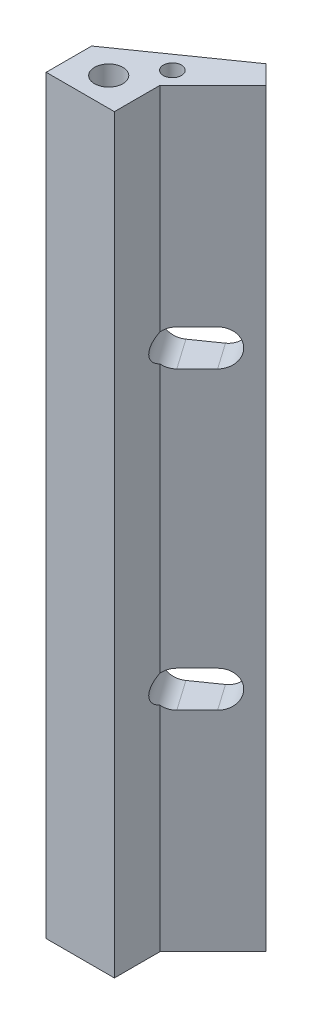
from build123d import *

# Parameters (mm, degrees)
BOSS_EXTRUDE1_DEPTH       = 66
M3X0_5_TAPPED_HOLE1_D     = 2.5
M3X0_5_TAPPED_HOLE1_DEPTH = 7.5
M3X0_5_TAPPED_HOLE1_TIP   = 0.751075774
M2X0_4_TAPPED_HOLE1_D     = 1.6
M2X0_4_TAPPED_HOLE1_DEPTH = 5.2
M2X0_4_TAPPED_HOLE1_TIP   = 0.480688495
M3X0_5_TAPPED_HOLE2_D     = 2.5
M3X0_5_TAPPED_HOLE2_DEPTH = 7.5
M3X0_5_TAPPED_HOLE2_TIP   = 0.751075774
M2X0_4_TAPPED_HOLE2_D     = 1.6
M2X0_4_TAPPED_HOLE2_DEPTH = 5.2
M2X0_4_TAPPED_HOLE2_TIP   = 0.480688495
CUT_EXTRUDE1_DEPTH        = 67.749502158


with BuildPart() as part:
    # Sketch1 → Boss-Extrude1 (new body)
    with BuildSketch(Plane(origin=(0, 66, 0), x_dir=(1, 0, 0), z_dir=(0, 1, 0))):
        Polygon((3.829824533, 1.282917234), (-5.180847956, -5.026423564), (-5.180847956, -9.026423564), (0.819152044, -9.026423564), (0.819152044, -5.026423564), (5.479158688, -0.366416921), align=None)
    extrude(amount=-BOSS_EXTRUDE1_DEPTH)

    # M3x0.5 Tapped Hole1
    with Locations(Plane(origin=(0, 0, 0), x_dir=(-1, 0, 0), z_dir=(0, -1, 0))):
        with Locations((2.180847956, -6.526423564)):
            Hole(M3X0_5_TAPPED_HOLE1_D / 2, depth=M3X0_5_TAPPED_HOLE1_DEPTH)
            with Locations((0, 0, -(M3X0_5_TAPPED_HOLE1_DEPTH + M3X0_5_TAPPED_HOLE1_TIP / 2))):  # 118° drill point
                Cone(0, M3X0_5_TAPPED_HOLE1_D / 2, M3X0_5_TAPPED_HOLE1_TIP, mode=Mode.SUBTRACT)

    # M2x0.4 Tapped Hole1
    with Locations(Plane(origin=(0, 0, 0), x_dir=(-1, 0, 0), z_dir=(0, -1, 0))):
        with Locations((-0.219152044, -3.326423564)):
            Hole(M2X0_4_TAPPED_HOLE1_D / 2, depth=M2X0_4_TAPPED_HOLE1_DEPTH)
            with Locations((0, 0, -(M2X0_4_TAPPED_HOLE1_DEPTH + M2X0_4_TAPPED_HOLE1_TIP / 2))):  # 118° drill point
                Cone(0, M2X0_4_TAPPED_HOLE1_D / 2, M2X0_4_TAPPED_HOLE1_TIP, mode=Mode.SUBTRACT)

    # M3x0.5 Tapped Hole2
    with Locations(Plane(origin=(-2.180847956, 66, 6.526423564), x_dir=(0, 0, 1), z_dir=(0, 1, 0))):
        with Locations((0, 0)):
            Hole(M3X0_5_TAPPED_HOLE2_D / 2, depth=M3X0_5_TAPPED_HOLE2_DEPTH)
            with Locations((0, 0, -(M3X0_5_TAPPED_HOLE2_DEPTH + M3X0_5_TAPPED_HOLE2_TIP / 2))):  # 118° drill point
                Cone(0, M3X0_5_TAPPED_HOLE2_D / 2, M3X0_5_TAPPED_HOLE2_TIP, mode=Mode.SUBTRACT)

    # M2x0.4 Tapped Hole2
    with Locations(Plane(origin=(0.219152044, 66, 3.326423564), x_dir=(0, 0, 1), z_dir=(0, 1, 0))):
        with Locations((0, 0)):
            Hole(M2X0_4_TAPPED_HOLE2_D / 2, depth=M2X0_4_TAPPED_HOLE2_DEPTH)
            with Locations((0, 0, -(M2X0_4_TAPPED_HOLE2_DEPTH + M2X0_4_TAPPED_HOLE2_TIP / 2))):  # 118° drill point
                Cone(0, M2X0_4_TAPPED_HOLE2_D / 2, M2X0_4_TAPPED_HOLE2_TIP, mode=Mode.SUBTRACT)

    # Sketch12 → Cut-Extrude1 (cut, through all)
    with BuildSketch(Plane(origin=(0.657199769, 0, 0.938578541), x_dir=(-0.8191520444364442, 0, 0.5735764361404623), z_dir=(-0.5735764361404623, 0, -0.8191520444364442))):
        with BuildLine():
            Line((-1.325998276, 44.400000009), (1.174001724, 44.400000009))
            ThreePointArc((1.174001724, 44.400000009), (2.774001716, 46.000000001), (1.174001724, 47.599999993))
            Line((1.174001724, 47.599999993), (-1.325998276, 47.599999993))
            ThreePointArc((-1.325998276, 47.599999993), (-2.925998268, 46.000000001), (-1.325998276, 44.400000009))
        make_face()
        with BuildLine():
            Line((-1.325998276, 18.400000007), (1.174001724, 18.400000007))
            ThreePointArc((1.174001724, 18.400000007), (2.774001716, 19.999999999), (1.174001724, 21.599999991))
            Line((1.174001724, 21.599999991), (-1.325998276, 21.599999991))
            ThreePointArc((-1.325998276, 21.599999991), (-2.925998268, 19.999999999), (-1.325998276, 18.400000007))
        make_face()
    extrude(amount=-CUT_EXTRUDE1_DEPTH, mode=Mode.SUBTRACT)


solid = part.part
